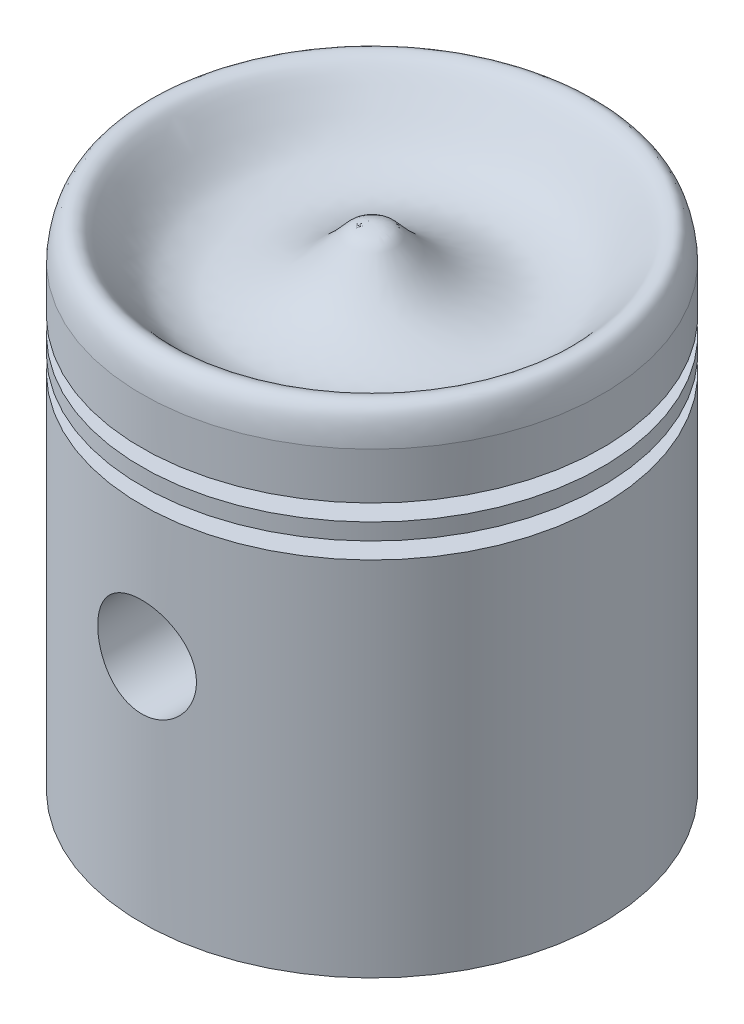
from build123d import *

# Parameters (mm, degrees)
CUT_EXTRUDE1_DEPTH      = 14.866731381
CUT_EXTRUDE1_DEPTH_BACK = 14.866731381
SKETCH2_R               = 1.5
SCALE1_SCALE            = 1.5


with BuildPart() as part:
    # Sketch1 → Revolve1 (revolve)
    with BuildSketch(Plane.XY, mode=Mode.PRIVATE) as revolve1_sk:
        with BuildLine():
            Line((-7, 8.712098042), (-7, 7.295703465))
            Line((-7, 7.295703465), (-6, 7.295703465))
            Line((-6, 7.295703465), (-6, 6.795703465))
            Line((-6, 6.795703465), (-7, 6.795703465))
            Line((-7, 6.795703465), (-7, 6.295703465))
            Line((-7, 6.295703465), (-6, 6.295703465))
            Line((-6, 6.295703465), (-6, 5.795703465))
            Line((-6, 5.795703465), (-7, 5.795703465))
            Line((-7, 5.795703465), (-7, -5.204296535))
            Line((-7, -5.204296535), (-6.25, -5.204296535))
            Line((-6.25, -5.204296535), (-5.050561785, -1.908867124))
            ThreePointArc((-5.050561785, -1.908867124), (-4.825715591, -1.069729704), (-4.75, -0.204296535))
            Line((-4.75, -0.204296535), (-4.75, 4.440083994))
            ThreePointArc((-4.75, 4.440083994), (-4.399873792, 5.550542455), (-3.476134386, 6.259352631))
            Line((-3.476134386, 6.259352631), (0, 7.524562078))
            Line((0, 7.524562078), (0, 8.566185983))
            Line((0, 8.566185983), (0, 9.69172121))
            add(Edge.make_bspline(
                [(-7, 8.712098042), (-6.915941705, 9.672888752), (-6.571850582, 9.786532429), (-6.017076444, 9.562037769), (-5.173496459, 8.320355176), (-3.929482137, 7.778040067), (-3.257853738, 7.770566701), (-1.62159895, 8.374478133), (-0.988089519, 9.078164836), (-0.514286955, 9.634062862), (-0.187546651, 9.695286605), (0, 9.69172121)],
                knots=[0, 0, 0, 0, 0.210746943, 0.254088111, 0.413486836, 0.459298403, 0.666392212, 0.714990212, 0.896680404, 0.92745251, 1, 1, 1, 1], degree=3))
        make_face()
    revolve(revolve1_sk.sketch.rotate(Axis((0, 2.420801252, 0), (0, 1, 0)), 270), axis=Axis((0, 2.420801252, 0), (0, 1, 0)))

    # Sketch2 → Cut-Extrude1 (cut, two sides: drawn at the far end of the back side and taken through both)
    with BuildSketch(Plane.XY.offset(-CUT_EXTRUDE1_DEPTH_BACK)):
        with Locations((0, 1.795703465)):
            Circle(SKETCH2_R)
    extrude(amount=CUT_EXTRUDE1_DEPTH + CUT_EXTRUDE1_DEPTH_BACK, mode=Mode.SUBTRACT)


with BuildPart() as part_1:
    # Scale1: scaled about (1.0568e-05, 2.939086838, 0.000578627)
    add(part.part.scale(SCALE1_SCALE).moved(Location((-5.284e-06, -1.469543419, -0.000289313))))


solid = part_1.part
